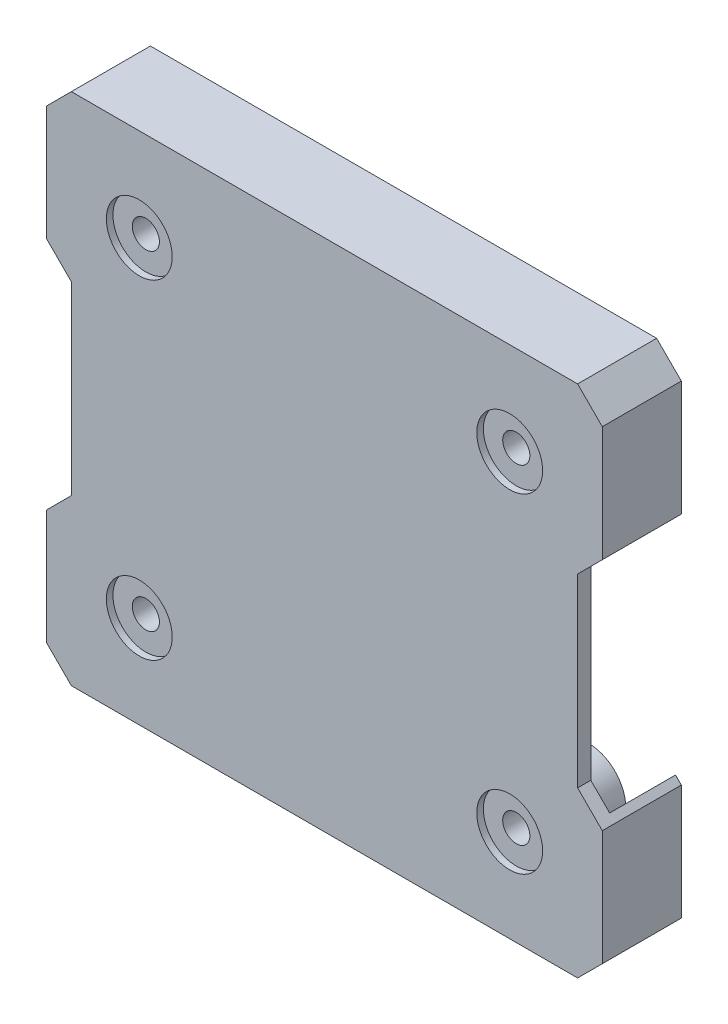
from build123d import *

# Parameters (mm, degrees)
SKETCH_1_W           = 67.5
SKETCH_1_H           = 62.5
EXTRUDE_1_DEPTH      = 1.6
SKETCH_2_R           = 1.65
CUT_EXTRUDE_1_DEPTH  = 10
CHAMFER_1_SIZE       = 3
SKETCH_3_R           = 1.65
EXTRUDE_2_DEPTH      = 4
SKETCH_4_R           = 4
CUT_EXTRUDE_2_DEPTH  = 0.8
SKETCH_5_R           = 4.5
EXTRUDE_3_DEPTH      = 6
EXTRUDE_4_DEPTH      = 8
SKETCH_7_W           = 10
SKETCH_7_H           = 1
CUT_EXTRUDE_3_DEPTH  = 5
EXTRUDE_5_DEPTH      = 2
CUT_EXTRUDE_4_DEPTH  = 8
FILLET_2_R           = 2
EXTRUDE_7_DEPTH      = 2
EXTRUDE_7_DEPTH_BACK = 2
SKETCH_12_R          = 4.5
SKETCH_12_R_2        = 1.65


with BuildPart() as part:
    # 草图1 → 凸台-拉伸1 (new body)
    with BuildSketch(Plane.XY):
        Rectangle(SKETCH_1_W, SKETCH_1_H)
    extrude(amount=EXTRUDE_1_DEPTH)

    # 草图2 → 切除-拉伸1 (cut)
    with BuildSketch(Plane.XY.offset(1.6)):
        with Locations((-22.5, 20)):
            Circle(SKETCH_2_R)
        with Locations((22.5, 20)):
            Circle(SKETCH_2_R)
        with Locations((22.5, -20)):
            Circle(SKETCH_2_R)
        with Locations((-22.5, -20)):
            Circle(SKETCH_2_R)
        Polygon((-30.75, 11.25), (-30.75, -11.25), (-33.75, -14.25), (-33.75, 14.25), align=None)
        Polygon((30.75, 11.25), (30.75, -11.25), (33.75, -14.25), (33.75, 14.25), align=None)
    extrude(amount=-CUT_EXTRUDE_1_DEPTH, mode=Mode.SUBTRACT)

    # 倒角1
    chamfer_1_edges = [part.edges().sort_by_distance(p)[0] for p in [
        (33.75, -31.25, 0.8),
        (-33.75, -31.25, 0.8),
        (-33.75, 31.25, 0.8),
        (33.75, 31.25, 0.8),
    ]]
    chamfer(chamfer_1_edges, length=CHAMFER_1_SIZE)

    # 草图3 → 凸台-拉伸2 (add)
    # profile 1 of 4: a face of its own
    with BuildSketch(Plane(origin=(0, 0, 0), x_dir=(-1, 0, 0), z_dir=(0, 0, -1))):
        Polygon((-19.901923789, 20), (-21.200961894, 22.25), (-23.799038106, 22.25), (-25.098076211, 20), (-23.799038106, 17.75), (-21.200961894, 17.75), align=None)
        with Locations(Location((-22.5, 20, 0), (0, 0, 180))):
            Circle(SKETCH_3_R, mode=Mode.SUBTRACT)
    # profile 2 of 4: a face of its own
    with BuildSketch(Plane(origin=(0, 0, 0), x_dir=(-1, 0, 0), z_dir=(0, 0, -1))):
        Polygon((25.098076211, 20), (23.799038106, 22.25), (21.200961894, 22.25), (19.901923789, 20), (21.200961894, 17.75), (23.799038106, 17.75), align=None)
        with Locations(Location((22.5, 20, 0), (0, 0, 180))):
            Circle(SKETCH_3_R, mode=Mode.SUBTRACT)
    # profile 3 of 4: a face of its own
    with BuildSketch(Plane(origin=(0, 0, 0), x_dir=(-1, 0, 0), z_dir=(0, 0, -1))):
        Polygon((25.098076211, -20), (23.799038106, -17.75), (21.200961894, -17.75), (19.901923789, -20), (21.200961894, -22.25), (23.799038106, -22.25), align=None)
        with Locations(Location((22.5, -20, 0), (0, 0, 180))):
            Circle(SKETCH_3_R, mode=Mode.SUBTRACT)
    # profile 4 of 4: a face of its own
    with BuildSketch(Plane(origin=(0, 0, 0), x_dir=(-1, 0, 0), z_dir=(0, 0, -1))):
        Polygon((-19.901923789, -20), (-21.200961894, -17.75), (-23.799038106, -17.75), (-25.098076211, -20), (-23.799038106, -22.25), (-21.200961894, -22.25), align=None)
        with Locations(Location((-22.5, -20, 0), (0, 0, 180))):
            Circle(SKETCH_3_R, mode=Mode.SUBTRACT)
    extrude(amount=EXTRUDE_2_DEPTH)

    # 草图4 → 切除-拉伸2 (cut)
    with BuildSketch(Plane.XY.offset(1.6)):
        with Locations((-22.5, 20)):
            Circle(SKETCH_4_R)
        with Locations((22.5, 20)):
            Circle(SKETCH_4_R)
        with Locations((22.5, -20)):
            Circle(SKETCH_4_R)
        with Locations((-22.5, -20)):
            Circle(SKETCH_4_R)
    extrude(amount=-CUT_EXTRUDE_2_DEPTH, mode=Mode.SUBTRACT)

    # 草图5 → 凸台-拉伸3 (add)
    # profile 1 of 4: a face of its own
    with BuildSketch(Plane(origin=(0, 0, 0), x_dir=(-1, 0, 0), z_dir=(0, 0, -1))):
        with Locations(Location((-22.5, 20, 0), (0, 0, 180))):
            Circle(SKETCH_5_R)
        Polygon((-21.200961894, 17.75), (-19.901923789, 20), (-21.200961894, 22.25), (-23.799038106, 22.25), (-25.098076211, 20), (-23.799038106, 17.75), align=None, mode=Mode.SUBTRACT)
    # profile 2 of 4: a face of its own
    with BuildSketch(Plane(origin=(0, 0, 0), x_dir=(-1, 0, 0), z_dir=(0, 0, -1))):
        with Locations(Location((22.5, 20, 0), (0, 0, 180))):
            Circle(SKETCH_5_R)
        Polygon((23.799038106, 17.75), (25.098076211, 20), (23.799038106, 22.25), (21.200961894, 22.25), (19.901923789, 20), (21.200961894, 17.75), align=None, mode=Mode.SUBTRACT)
    # profile 3 of 4: a face of its own
    with BuildSketch(Plane(origin=(0, 0, 0), x_dir=(-1, 0, 0), z_dir=(0, 0, -1))):
        with Locations(Location((22.5, -20, 0), (0, 0, 180))):
            Circle(SKETCH_5_R)
        Polygon((23.799038106, -22.25), (25.098076211, -20), (23.799038106, -17.75), (21.200961894, -17.75), (19.901923789, -20), (21.200961894, -22.25), align=None, mode=Mode.SUBTRACT)
    # profile 4 of 4: a face of its own
    with BuildSketch(Plane(origin=(0, 0, 0), x_dir=(-1, 0, 0), z_dir=(0, 0, -1))):
        with Locations(Location((-22.5, -20, 0), (0, 0, 180))):
            Circle(SKETCH_5_R)
        Polygon((-21.200961894, -22.25), (-19.901923789, -20), (-21.200961894, -17.75), (-23.799038106, -17.75), (-25.098076211, -20), (-23.799038106, -22.25), align=None, mode=Mode.SUBTRACT)
    extrude(amount=EXTRUDE_3_DEPTH)

    # 草图6 → 凸台-拉伸4 (add)
    with BuildSketch(Plane(origin=(0, 0, 0), x_dir=(-1, 0, 0), z_dir=(0, 0, -1))):
        Polygon((-30.75, -31.25), (30.75, -31.25), (33.75, -28.25), (33.75, -14.25), (30.75, -11.25), (30.75, 11.25), (33.75, 14.25), (33.75, 28.25), (30.75, 31.25), (-30.75, 31.25), (-33.75, 28.25), (-33.75, 14.25), (-30.75, 11.25), (-30.75, -11.25), (-33.75, -14.25), (-33.75, -28.25), align=None)
        Polygon((-30.335786438, -30.25), (30.335786438, -30.25), (32.75, -27.835786438), (32.75, -14.664213562), (29.75, -11.664213562), (29.75, 11.664213562), (32.75, 14.664213562), (32.75, 27.835786438), (30.335786438, 30.25), (-30.335786438, 30.25), (-32.75, 27.835786438), (-32.75, 14.664213562), (-29.75, 11.664213562), (-29.75, -11.664213562), (-32.75, -14.664213562), (-32.75, -27.835786438), align=None, mode=Mode.SUBTRACT)
    extrude(amount=EXTRUDE_4_DEPTH)

    # 草图7 → 切除-拉伸3 (cut)
    with BuildSketch(Plane(origin=(0, 0, -8), x_dir=(-1, 0, 0), z_dir=(0, 0, -1))):
        with Locations((0, -30.75)):
            Rectangle(SKETCH_7_W, SKETCH_7_H)
    extrude(amount=-CUT_EXTRUDE_3_DEPTH, mode=Mode.SUBTRACT)

    # 草图8 → 凸台-拉伸5 (add)
    with BuildSketch(Plane(origin=(0, 0, 0), x_dir=(-1, 0, 0), z_dir=(0, 0, -1))):
        with BuildLine():
            Line((-1.5, -11.14955156), (-1.5, -12.157816416))
            ThreePointArc((-1.5, -12.157816416), (0, 12.25), (1.5, -12.157816416))
            Line((1.5, -12.157816416), (1.5, -11.14955156))
            ThreePointArc((1.5, -11.14955156), (0, 11.25), (-1.5, -11.14955156))
        make_face()
    extrude(amount=EXTRUDE_5_DEPTH)

    # 草图9 → 切除-拉伸4 (cut)
    with BuildSketch(Plane(origin=(0, 0, -8), x_dir=(-1, 0, 0), z_dir=(0, 0, -1))):
        Polygon((29.75, 11.664213562), (32.335786438, 14.25), (33.042893219, 13.542893219), (30.75, 11.25), (30.75, -11.25), (33.042893219, -13.542893219), (32.335786438, -14.25), (29.75, -11.664213562), align=None)
        Polygon((-33.042893219, 13.542893219), (-32.335786438, 14.25), (-29.75, 11.664213562), (-29.75, -11.664213562), (-32.335786438, -14.25), (-33.042893219, -13.542893219), (-30.75, -11.25), (-30.75, 11.25), align=None)
    extrude(amount=-CUT_EXTRUDE_4_DEPTH, mode=Mode.SUBTRACT)

    # 圆角2
    fillet_2_edges = [part.edges().sort_by_distance(p)[0] for p in [
        (5, -30.75, -3),
        (-5, -30.75, -3),
    ]]
    fillet(fillet_2_edges, radius=FILLET_2_R)

    # 草图12 → 凸台-拉伸7 (add, two sides: drawn at the far end of the back side and taken through both)
    # profile 1 of 4: a face of its own
    with BuildSketch(Plane(origin=(0, 0, -6), x_dir=(-1, 0, 0), z_dir=(0, 0, -1)).offset(-EXTRUDE_7_DEPTH_BACK)):
        with Locations(Location((-22.5, 20, 0), (0, 0, 180))):
            Circle(SKETCH_12_R)
        with Locations(Location((-22.5, 20, 0), (0, 0, 180))):
            Circle(SKETCH_12_R_2, mode=Mode.SUBTRACT)
    # profile 2 of 4: a face of its own
    with BuildSketch(Plane(origin=(0, 0, -6), x_dir=(-1, 0, 0), z_dir=(0, 0, -1)).offset(-EXTRUDE_7_DEPTH_BACK)):
        with Locations(Location((22.5, 20, 0), (0, 0, 180))):
            Circle(SKETCH_12_R)
        with Locations(Location((22.5, 20, 0), (0, 0, 180))):
            Circle(SKETCH_12_R_2, mode=Mode.SUBTRACT)
    # profile 3 of 4: a face of its own
    with BuildSketch(Plane(origin=(0, 0, -6), x_dir=(-1, 0, 0), z_dir=(0, 0, -1)).offset(-EXTRUDE_7_DEPTH_BACK)):
        with Locations(Location((-22.5, -20, 0), (0, 0, 180))):
            Circle(SKETCH_12_R)
        with Locations(Location((-22.5, -20, 0), (0, 0, 180))):
            Circle(SKETCH_12_R_2, mode=Mode.SUBTRACT)
    # profile 4 of 4: a face of its own
    with BuildSketch(Plane(origin=(0, 0, -6), x_dir=(-1, 0, 0), z_dir=(0, 0, -1)).offset(-EXTRUDE_7_DEPTH_BACK)):
        with Locations(Location((22.5, -20, 0), (0, 0, 180))):
            Circle(SKETCH_12_R)
        with Locations(Location((22.5, -20, 0), (0, 0, 180))):
            Circle(SKETCH_12_R_2, mode=Mode.SUBTRACT)
    extrude(amount=EXTRUDE_7_DEPTH + EXTRUDE_7_DEPTH_BACK)


solid = part.part
